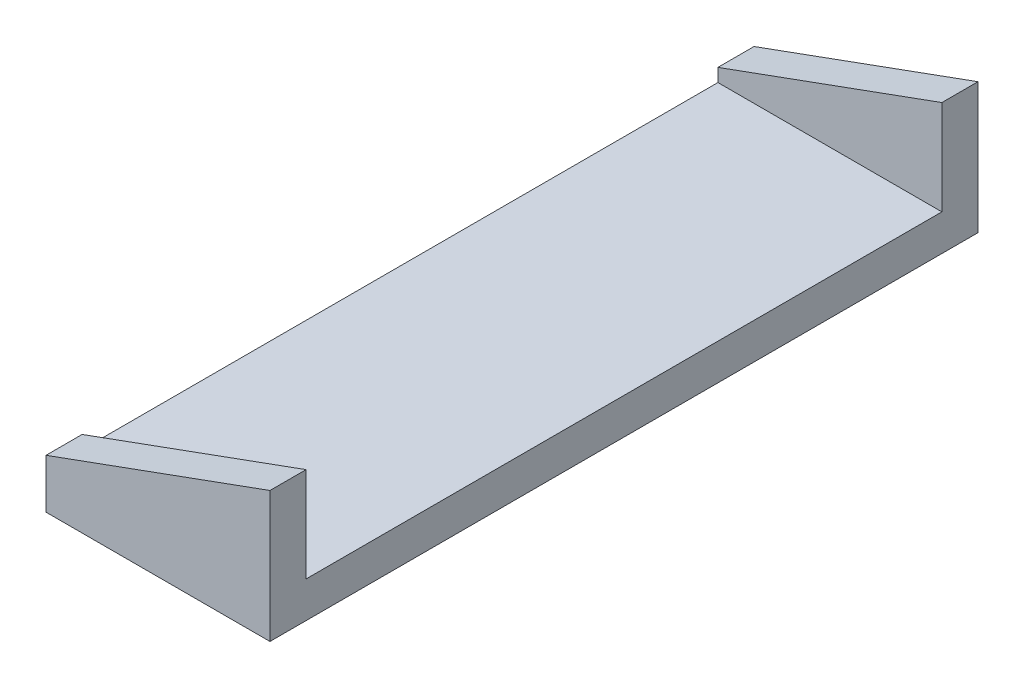
from build123d import *

# Parameters (mm, degrees)
SKETCH1_W           = 457.2
SKETCH1_H           = 1244.6
BOSS_EXTRUDE1_DEPTH = 63.5
SKETCH4_W           = 457.2
SKETCH4_H           = 63.5
BOSS_EXTRUDE2_DEPTH = 266.7
CUT_EXTRUDE7_DEPTH  = 100.076
SKETCH12_W          = 63.5
SKETCH12_H          = 1244.6
CUT_EXTRUDE8_DEPTH  = 253.746


with BuildPart() as part:
    # Sketch1 → Boss-Extrude1 (new body)
    with BuildSketch(Plane(origin=(0, 0, 0), x_dir=(1, 0, 0), z_dir=(0, 1, 0))):
        with Locations((228.6, 622.3)):
            Rectangle(SKETCH1_W, SKETCH1_H)
    extrude(amount=BOSS_EXTRUDE1_DEPTH)

    # Sketch4 → Boss-Extrude2 (add)
    with BuildSketch(Plane(origin=(0, 63.5, 0), x_dir=(1, 0, 0), z_dir=(0, 1, 0))):
        with Locations((228.6, 1212.85)):
            Rectangle(SKETCH4_W, SKETCH4_H)
    boss_extrude2 = extrude(amount=BOSS_EXTRUDE2_DEPTH)

    # Mirror7: Boss-Extrude2 across plane
    add(boss_extrude2.mirror(Plane(origin=(0, 0, -622.3), x_dir=(1, 0, 0), z_dir=(0, 0, -1))))

    # Sketch11 → Cut-Extrude7 (cut)
    with BuildSketch(Plane.XY.offset(-1181.1)):
        Polygon((0, 63.5), (0, 330.2), (457.2, 330.2), (457.2, 229.907191107), align=None)
    cut_extrude7 = extrude(amount=-CUT_EXTRUDE7_DEPTH, mode=Mode.SUBTRACT)

    # Mirror8: Cut-Extrude7 across plane
    add(cut_extrude7.mirror(Plane(origin=(0, 0, -622.3), x_dir=(1, 0, 0), z_dir=(0, 0, -1))), mode=Mode.SUBTRACT)

    # Sketch12 → Cut-Extrude8 (cut)
    with BuildSketch(Plane.XZ):
        with Locations((31.75, -622.3)):
            Rectangle(SKETCH12_W, SKETCH12_H)
    extrude(amount=-CUT_EXTRUDE8_DEPTH, mode=Mode.SUBTRACT)


solid = part.part
